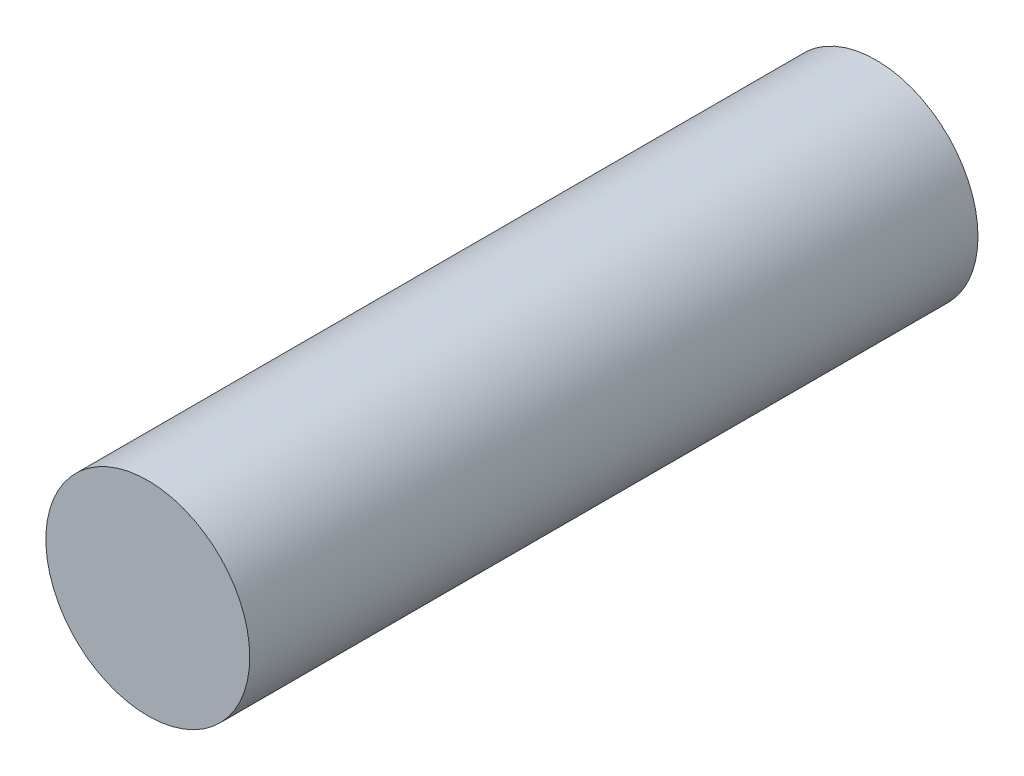
from build123d import *

# Parameters (mm, degrees)
GRIP_PROFILE_R   = 14
GRIP_100MM_DEPTH = 100


with BuildPart() as part:
    # Grip_Profile → Grip_100mm (new body)
    with BuildSketch(Plane.XY):
        Circle(GRIP_PROFILE_R)
    extrude(amount=GRIP_100MM_DEPTH)


solid = part.part
